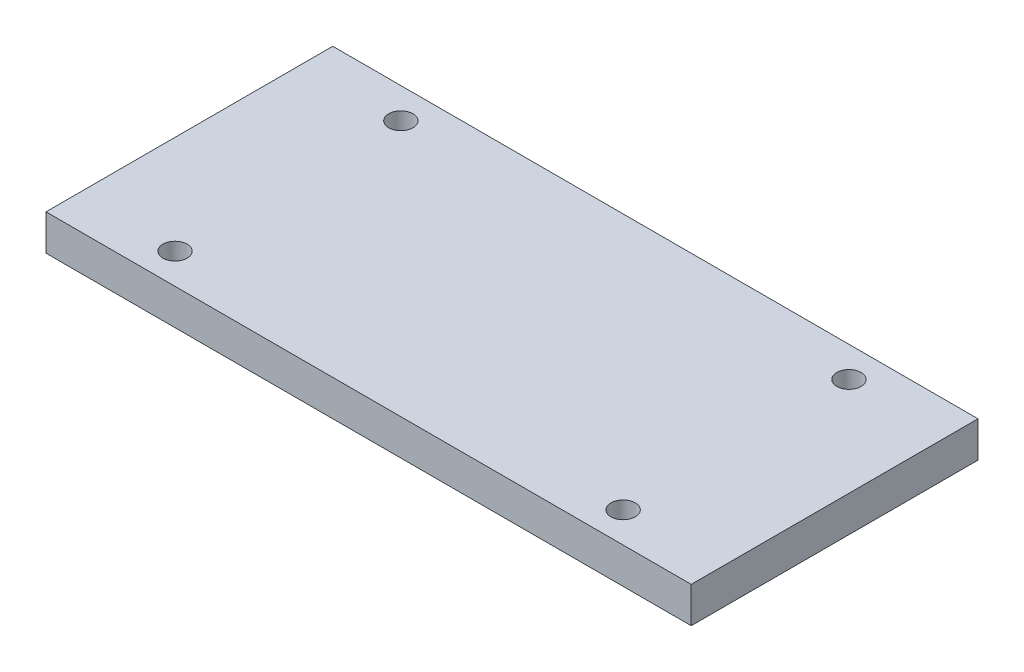
from build123d import *

# Parameters (mm, degrees)
SKETCH1_W                    = 114.3
SKETCH1_H                    = 50.8
BOSS_EXTRUDE1_DEPTH          = 3.175
F_18_0_1695_DIAMETER_HOLE1_D = 4.3053


with BuildPart() as part:
    # Sketch1 → Boss-Extrude1 (new, symmetric)
    with BuildSketch(Plane(origin=(0, 0, 0), x_dir=(1, 0, 0), z_dir=(0, 1, 0))):
        Rectangle(SKETCH1_W, SKETCH1_H)
    extrude(amount=BOSS_EXTRUDE1_DEPTH, both=True)

    # #18 (0.1695) Diameter Hole1 (through all)
    with Locations(Plane(origin=(0, -3.175, 0), x_dir=(-1, 0, 0), z_dir=(0, -1, 0))):
        with Locations((-39.6875, -20.0025), (-39.6875, 20.0025), (39.6875, 20.0025), (39.6875, -20.0025)):
            Hole(F_18_0_1695_DIAMETER_HOLE1_D / 2)


solid = part.part
